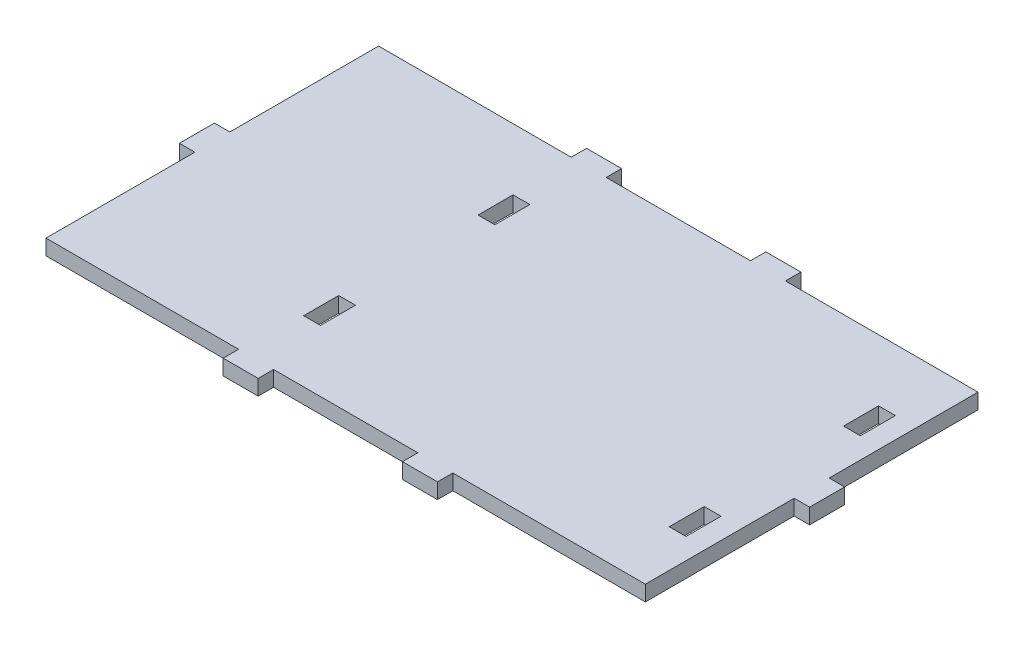
from build123d import *

# Parameters (mm, degrees)
BOSS_EXTRUDE1_DEPTH = 5.588
SKETCH2_W           = 6.096
SKETCH2_H           = 12.7
CUT_EXTRUDE1_DEPTH  = 5.588


with BuildPart() as part:
    # Sketch1 → Boss-Extrude1 (new body)
    with BuildSketch(Plane(origin=(0, 0, 0), x_dir=(1, 0, 0), z_dir=(0, 1, 0))):
        Polygon((-108.712, 6.35), (-114.3, 6.35), (-114.3, -6.35), (-108.712, -6.35), (-108.712, -60.325), (-38.862, -60.325), (-38.862, -65.913), (-26.162, -65.913), (-26.162, -60.325), (26.162, -60.325), (26.162, -65.913), (38.862, -65.913), (38.862, -60.325), (108.712, -60.325), (108.712, -6.35), (114.3, -6.35), (114.3, 6.35), (108.712, 6.35), (108.712, 60.325), (38.862, 60.325), (38.862, 65.913), (26.162, 65.913), (26.162, 60.325), (-26.162, 60.325), (-26.162, 65.913), (-38.862, 65.913), (-38.862, 60.325), (-108.712, 60.325), align=None)
    extrude(amount=BOSS_EXTRUDE1_DEPTH)

    # Sketch2 → Cut-Extrude1 (cut)
    with BuildSketch(Plane.XZ):
        with Locations((-34.544, 31.623)):
            Rectangle(SKETCH2_W, SKETCH2_H)
        with Locations((98.044, 31.623)):
            Rectangle(SKETCH2_W, SKETCH2_H)
        with Locations((98.044, -31.623)):
            Rectangle(SKETCH2_W, SKETCH2_H)
        with Locations((-34.544, -31.623)):
            Rectangle(SKETCH2_W, SKETCH2_H)
    extrude(amount=-CUT_EXTRUDE1_DEPTH, mode=Mode.SUBTRACT)


solid = part.part
